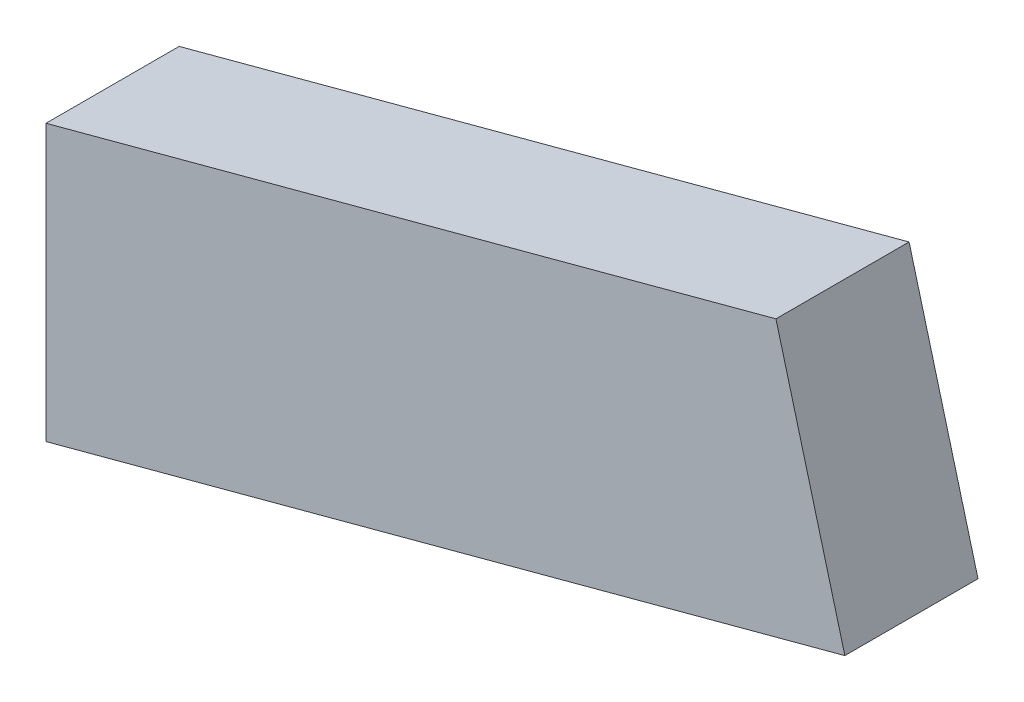
from build123d import *

# Parameters (mm, degrees)
BOSS_EXTRUDE1_DEPTH = 0.5


with BuildPart() as part:
    # Sketch2 → Boss-Extrude1 (new body)
    with BuildSketch(Plane.XY):
        Polygon((0, 0), (0, 1.03527618), (2.741180955, 1.769773404), (3, 0.803847577), align=None)
    extrude(amount=BOSS_EXTRUDE1_DEPTH)


solid = part.part
